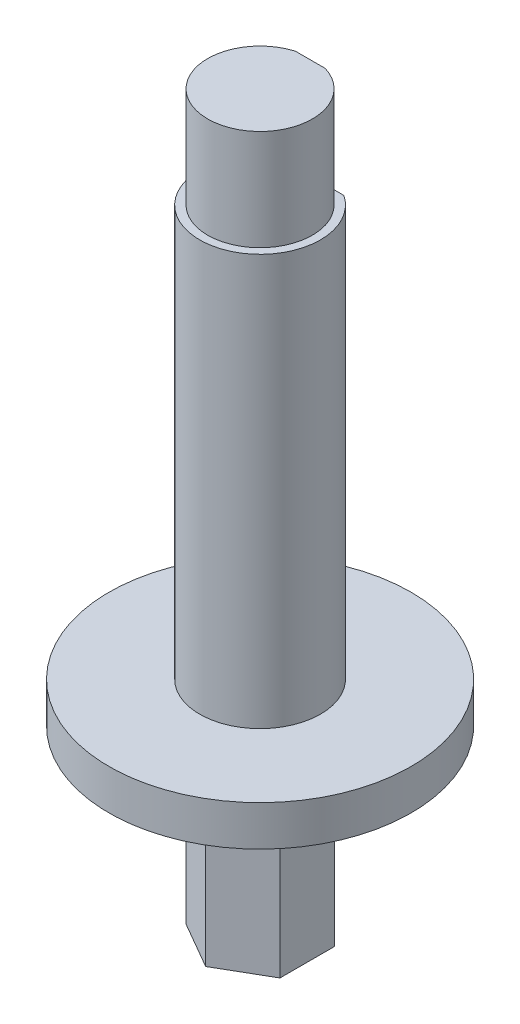
from build123d import *

# Parameters (mm, degrees)
BOSS_EXTRUDE1_DEPTH = 9
BOSS_EXTRUDE2_DEPTH = 22.4
SKETCH3_R           = 7.5
BOSS_EXTRUDE3_DEPTH = 2
BOSS_EXTRUDE4_DEPTH = 5


with BuildPart() as part:
    # Sketch1 → Boss-Extrude1 (new body)
    with BuildSketch(Plane(origin=(0, 0, 0), x_dir=(1, 0, 0), z_dir=(0, 1, 0))):
        Polygon((0, 2.7), (-2.33826859, 1.35), (-2.33826859, -1.35), (0, -2.7), (2.33826859, -1.35), (2.33826859, 1.35), align=None)
    extrude(amount=BOSS_EXTRUDE1_DEPTH)

    # Sketch2 → Boss-Extrude2 (add)
    with BuildSketch(Plane(origin=(0, 9, 0), x_dir=(1, 0, 0), z_dir=(0, 1, 0))):
        with BuildLine():
            Line((-1.667829968, 2.493660602), (1.667829968, 2.493660602))
            ThreePointArc((1.667829968, 2.493660602), (0, -3), (-1.667829968, 2.493660602))
        make_face()
    extrude(amount=BOSS_EXTRUDE2_DEPTH)

    # Sketch3 → Boss-Extrude3 (add)
    with BuildSketch(Plane.XZ.offset(-9)):
        with Locations(Location((0, 0, 0), (0, 0, 270))):
            Circle(SKETCH3_R)
    extrude(amount=-BOSS_EXTRUDE3_DEPTH)

    # Sketch4 → Boss-Extrude4 (add)
    with BuildSketch(Plane(origin=(0, 31.4, 0), x_dir=(1, 0, 0), z_dir=(0, 1, 0))):
        with BuildLine():
            Line((-0.735973371, 2.493660602), (0.735973371, 2.493660602))
            ThreePointArc((0.735973371, 2.493660602), (0, -2.6), (-0.735973371, 2.493660602))
        make_face()
    extrude(amount=BOSS_EXTRUDE4_DEPTH)


solid = part.part
